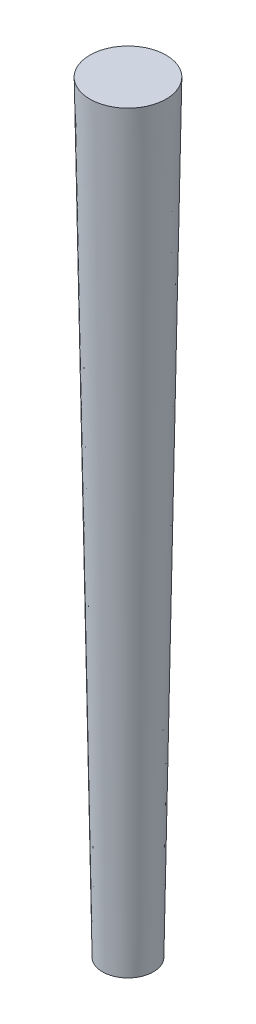
from build123d import *


with BuildPart() as part:
    # Sketch1 → Revolve1 (revolve)
    with BuildSketch(Plane.XY, mode=Mode.PRIVATE) as revolve1_sk:
        Polygon((0, 0), (2, 0), (3, 60), (0, 60), align=None)
    revolve(revolve1_sk.sketch.rotate(Axis((0, 60, 0), (0, -1, 0)), 180), axis=Axis((0, 60, 0), (0, -1, 0)))


solid = part.part
